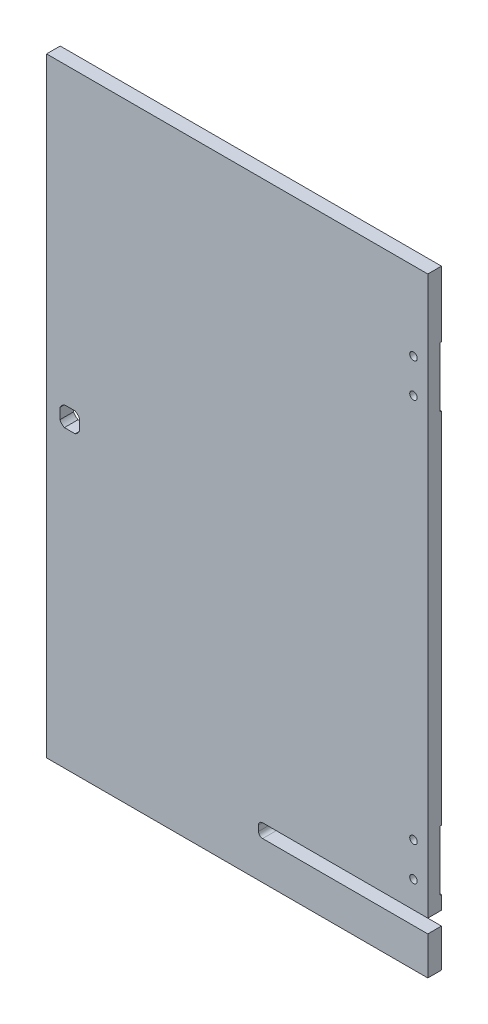
from build123d import *

# Parameters (mm, degrees)
SKETCH1_W           = 279.5
SKETCH1_H           = 447
BOSS_EXTRUDE1_DEPTH = 10
CUT_EXTRUDE1_DEPTH  = 1
SKETCH3_R           = 2.75
CUT_EXTRUDE2_DEPTH  = 264.748578195
CUT_EXTRUDE3_DEPTH  = 264.784594888
CUT_EXTRUDE4_DEPTH  = 264.784594888


with BuildPart() as part:
    # Sketch1 → Boss-Extrude1 (new body)
    with BuildSketch(Plane.XY):
        Rectangle(SKETCH1_W, SKETCH1_H)
    extrude(amount=BOSS_EXTRUDE1_DEPTH)

    # Sketch2 → Cut-Extrude1 (cut)
    with BuildSketch(Plane(origin=(0, 0, 0), x_dir=(-1, 0, 0), z_dir=(0, 0, -1))):
        with BuildLine():
            Line((-139.75, 175.5), (-121.75, 175.5))
            ThreePointArc((-121.75, 175.5), (-119.628679656, 174.621320344), (-118.75, 172.5))
            Line((-118.75, 172.5), (-118.75, 134.5))
            ThreePointArc((-118.75, 134.5), (-119.628679656, 132.378679656), (-121.75, 131.5))
            Line((-121.75, 131.5), (-139.75, 131.5))
            Line((-139.75, 131.5), (-139.75, 175.5))
        make_face()
        with BuildLine():
            Line((-139.75, -131.5), (-121.75, -131.5))
            ThreePointArc((-121.75, -131.5), (-119.628679656, -132.378679656), (-118.75, -134.5))
            Line((-118.75, -134.5), (-118.75, -172.5))
            ThreePointArc((-118.75, -172.5), (-119.628679656, -174.621320344), (-121.75, -175.5))
            Line((-121.75, -175.5), (-139.75, -175.5))
            Line((-139.75, -175.5), (-139.75, -131.5))
        make_face()
    extrude(amount=-CUT_EXTRUDE1_DEPTH, mode=Mode.SUBTRACT)

    # Sketch3 → Cut-Extrude2 (cut, through all)
    with BuildSketch(Plane(origin=(0, 0, 1), x_dir=(-1, 0, 0), z_dir=(0, 0, -1))):
        with Locations((-129.25, 166)):
            Circle(SKETCH3_R)
        with Locations((-129.25, 141)):
            Circle(SKETCH3_R)
        with Locations((-129.25, -141)):
            Circle(SKETCH3_R)
        with Locations((-129.25, -166)):
            Circle(SKETCH3_R)
    extrude(amount=-CUT_EXTRUDE2_DEPTH, mode=Mode.SUBTRACT)

    # Sketch4 → Cut-Extrude3 (cut, through all)
    with BuildSketch(Plane(origin=(0, 0, 0), x_dir=(-1, 0, 0), z_dir=(0, 0, -1))):
        with BuildLine():
            Line((-140.75, -185.5), (-18.647208755, -185.5))
            ThreePointArc((-18.647208755, -185.5), (-16.525888411, -186.378679656), (-15.647208755, -188.5))
            Line((-15.647208755, -188.5), (-15.647208755, -192.5))
            ThreePointArc((-15.647208755, -192.5), (-16.525888411, -194.621320344), (-18.647208755, -195.5))
            Line((-18.647208755, -195.5), (-140.75, -195.5))
            Line((-140.75, -195.5), (-140.75, -185.5))
        make_face()
    extrude(amount=-CUT_EXTRUDE3_DEPTH, mode=Mode.SUBTRACT)

    # Sketch5 → Cut-Extrude4 (cut, through all)
    with BuildSketch(Plane.XY.offset(10)):
        with BuildLine():
            Line((-118.812996063, 7.25), (-126.687003937, 7.25))
            ThreePointArc((-126.687003937, 7.25), (-128.583630945, 5.833630945), (-130, 3.937003937))
            Line((-130, 3.937003937), (-130, -3.937003937))
            ThreePointArc((-130, -3.937003937), (-128.583630945, -5.833630945), (-126.687003937, -7.25))
            Line((-126.687003937, -7.25), (-118.812996063, -7.25))
            ThreePointArc((-118.812996063, -7.25), (-116.916369055, -5.833630945), (-115.5, -3.937003937))
            Line((-115.5, -3.937003937), (-115.5, 3.937003937))
            ThreePointArc((-115.5, 3.937003937), (-116.916369055, 5.833630945), (-118.812996063, 7.25))
        make_face()
    extrude(amount=-CUT_EXTRUDE4_DEPTH, mode=Mode.SUBTRACT)


solid = part.part
